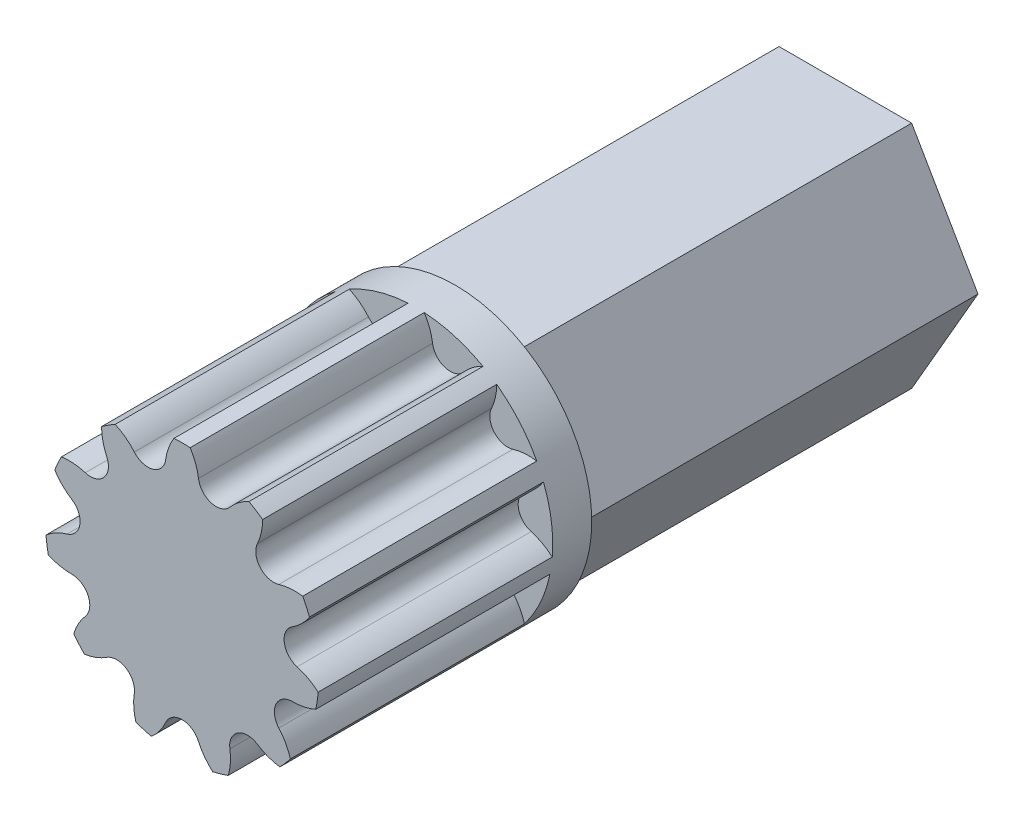
from build123d import *

# Parameters (mm, degrees)
BOSS_EXTRUDE1_DEPTH = 10
SKETCH2_R           = 3.5
BOSS_EXTRUDE2_DEPTH = 7
SKETCH5_OUTSIDE_W   = 12.934
SKETCH5_OUTSIDE_H   = 12.934
CUT_EXTRUDE1_DEPTH  = 6


with BuildPart() as part:
    # Sketch1 → Boss-Extrude1 (new body)
    with BuildSketch(Plane.XY):
        Polygon((3.4, 0), (1.7, 2.944486373), (-1.7, 2.944486373), (-3.4, 0), (-1.7, -2.944486373), (1.7, -2.944486373), align=None)
    extrude(amount=BOSS_EXTRUDE1_DEPTH)

    # Sketch2 → Boss-Extrude2 (add)
    with BuildSketch(Plane.XY.offset(10)):
        Circle(SKETCH2_R)
    extrude(amount=BOSS_EXTRUDE2_DEPTH)

    # Sketch5 outside → Cut-Extrude1 (cut)
    with BuildSketch(Plane.XY.offset(17)):
        Rectangle(SKETCH5_OUTSIDE_W, SKETCH5_OUTSIDE_H)
        with BuildLine():
            ThreePointArc((-1.225048855, -2.680805064), (-1.222210326, -2.658421079), (-1.220475879, -2.635924597))
            ThreePointArc((-1.220475879, -2.635924597), (-1.430570177, -2.226010646), (-1.890717348, -2.20518656))
            ThreePointArc((-1.890717348, -2.20518656), (-1.910460352, -2.216109645), (-1.929642373, -2.227990304))
            ThreePointArc((-1.929642373, -2.227990304), (-2.205665987, -2.368094557), (-2.505525497, -2.444922359))
            ThreePointArc((-2.505525497, -2.444922359), (-2.645696022, -2.292508653), (-2.776610031, -2.13207413))
            ThreePointArc((-2.776610031, -2.13207413), (-2.657889767, -1.846200494), (-2.479929318, -1.592925316))
            ThreePointArc((-2.479929318, -1.592925316), (-2.4654397, -1.575629335), (-2.451818074, -1.557641803))
            ThreePointArc((-2.451818074, -1.557641803), (-2.40694443, -1.09921469), (-2.782786513, -0.832922011))
            ThreePointArc((-2.782786513, -0.832922011), (-2.80530085, -0.831437221), (-2.827860963, -0.831061285))
            ThreePointArc((-2.827860963, -0.831061285), (-3.135812881, -0.79969485), (-3.429606999, -0.702210219))
            ThreePointArc((-3.429606999, -0.702210219), (-3.465124877, -0.498209743), (-3.488519299, -0.292466177))
            ThreePointArc((-3.488519299, -0.292466177), (-3.234090501, -0.116158991), (-2.947449745, 0.000696964))
            ThreePointArc((-2.947449745, 0.000696964), (-2.925909389, 0.00741359), (-2.904725354, 0.015181258))
            ThreePointArc((-2.904725354, 0.015181258), (-2.619130834, 0.376574163), (-2.791340622, 0.80378939))
            ThreePointArc((-2.791340622, 0.80378939), (-2.80947815, 0.817210645), (-2.828253678, 0.829723821))
            ThreePointArc((-2.828253678, 0.829723821), (-3.070361342, 1.022602322), (-3.264812511, 1.263448704))
            ThreePointArc((-3.264812511, 1.263448704), (-3.184401067, 1.454267239), (-3.092848337, 1.63999772))
            ThreePointArc((-3.092848337, 1.63999772), (-2.783490351, 1.65076217), (-2.479175704, 1.594097963))
            ThreePointArc((-2.479175704, 1.594097963), (-2.457423521, 1.588102753), (-2.435402858, 1.583184377))
            ThreePointArc((-2.435402858, 1.583184377), (-1.999761704, 1.73280338), (-1.913663807, 2.18530334))
            ThreePointArc((-1.913663807, 2.18530334), (-1.921665988, 2.206399906), (-1.930695833, 2.227077476))
            ThreePointArc((-1.930695833, 2.227077476), (-2.030091771, 2.520230481), (-2.063463119, 2.82797159))
            ThreePointArc((-2.063463119, 2.82797159), (-1.892652419, 2.945024649), (-1.715219882, 3.051773929))
            ThreePointArc((-1.715219882, 3.051773929), (-1.449151682, 2.893578006), (-1.223780893, 2.681384122))
            ThreePointArc((-1.223780893, 2.681384122), (-1.208723048, 2.664580512), (-1.192857163, 2.648537642))
            ThreePointArc((-1.192857163, 2.648537642), (-0.745482362, 2.538879767), (-0.428412254, 2.87299892))
            ThreePointArc((-0.428412254, 2.87299892), (-0.423738452, 2.895072786), (-0.420155704, 2.917349768))
            ThreePointArc((-0.420155704, 2.917349768), (-0.345282406, 3.217703271), (-0.206978766, 3.494633479))
            ThreePointArc((-0.206978766, 3.494633479), (-0.103534673, 3.499226191), (0, 3.500757541))
            ThreePointArc((0, 3.500757541), (0.103534673, 3.499226191), (0.206978766, 3.494633479))
            ThreePointArc((0.206978766, 3.494633479), (0.345282406, 3.217703271), (0.420155704, 2.917349768))
            ThreePointArc((0.420155704, 2.917349768), (0.423738452, 2.895072786), (0.428412254, 2.87299892))
            ThreePointArc((0.428412254, 2.87299892), (0.745482362, 2.538879767), (1.192857163, 2.648537642))
            ThreePointArc((1.192857163, 2.648537642), (1.208723048, 2.664580512), (1.223780893, 2.681384122))
            ThreePointArc((1.223780893, 2.681384122), (1.449151682, 2.893578006), (1.715219882, 3.051773929))
            ThreePointArc((1.715219882, 3.051773929), (1.892652419, 2.945024649), (2.063463119, 2.82797159))
            ThreePointArc((2.063463119, 2.82797159), (2.030091771, 2.520230481), (1.930695833, 2.227077476))
            ThreePointArc((1.930695833, 2.227077476), (1.921665988, 2.206399906), (1.913663807, 2.18530334))
            ThreePointArc((1.913663807, 2.18530334), (1.999761704, 1.73280338), (2.435402858, 1.583184377))
            ThreePointArc((2.435402858, 1.583184377), (2.457423521, 1.588102753), (2.479175704, 1.594097963))
            ThreePointArc((2.479175704, 1.594097963), (2.783490351, 1.65076217), (3.092848337, 1.63999772))
            ThreePointArc((3.092848337, 1.63999772), (3.184401067, 1.454267239), (3.264812511, 1.263448704))
            ThreePointArc((3.264812511, 1.263448704), (3.070361342, 1.022602322), (2.828253678, 0.829723821))
            ThreePointArc((2.828253678, 0.829723821), (2.80947815, 0.817210645), (2.791340622, 0.80378939))
            ThreePointArc((2.791340622, 0.80378939), (2.619130834, 0.376574163), (2.904725354, 0.015181258))
            ThreePointArc((2.904725354, 0.015181258), (2.925909389, 0.00741359), (2.947449745, 0.000696964))
            ThreePointArc((2.947449745, 0.000696964), (3.234090501, -0.116158991), (3.488519299, -0.292466177))
            ThreePointArc((3.488519299, -0.292466177), (3.465124877, -0.498209743), (3.429606999, -0.702210219))
            ThreePointArc((3.429606999, -0.702210219), (3.135812881, -0.79969485), (2.827860963, -0.831061285))
            ThreePointArc((2.827860963, -0.831061285), (2.80530085, -0.831437221), (2.782786513, -0.832922011))
            ThreePointArc((2.782786513, -0.832922011), (2.40694443, -1.09921469), (2.451818074, -1.557641803))
            ThreePointArc((2.451818074, -1.557641803), (2.4654397, -1.575629335), (2.479929318, -1.592925316))
            ThreePointArc((2.479929318, -1.592925316), (2.657889767, -1.846200494), (2.776610031, -2.13207413))
            ThreePointArc((2.776610031, -2.13207413), (2.645696022, -2.292508653), (2.505525497, -2.444922359))
            ThreePointArc((2.505525497, -2.444922359), (2.205665989, -2.368094556), (1.929642376, -2.227990303))
            ThreePointArc((1.929642376, -2.227990303), (1.910460355, -2.216109643), (1.890717351, -2.205186558))
            ThreePointArc((1.890717351, -2.205186558), (1.430570178, -2.226010644), (1.220475879, -2.635924598))
            ThreePointArc((1.220475879, -2.635924598), (1.222210326, -2.65842108), (1.225048855, -2.680805065))
            ThreePointArc((1.225048855, -2.680805065), (1.237827812, -2.990086385), (1.183146697, -3.294763611))
            ThreePointArc((1.183146697, -3.294763611), (0.986277373, -3.358952263), (0.785957353, -3.411388925))
            ThreePointArc((0.785957353, -3.411388925), (0.575235727, -3.184640974), (0.418775964, -2.917548145))
            ThreePointArc((0.418775964, -2.917548145), (0.409062191, -2.897182914), (0.398358784, -2.877319957))
            ThreePointArc((0.398358784, -2.877319957), (0, -2.646063949), (-0.398358784, -2.877319956))
            ThreePointArc((-0.398358784, -2.877319956), (-0.409062191, -2.897182914), (-0.418775964, -2.917548145))
            ThreePointArc((-0.418775964, -2.917548145), (-0.575235727, -3.184640974), (-0.785957353, -3.411388925))
            ThreePointArc((-0.785957353, -3.411388925), (-0.986277373, -3.358952263), (-1.183146697, -3.294763611))
            ThreePointArc((-1.183146697, -3.294763611), (-1.237827813, -2.990086384), (-1.225048855, -2.680805064))
        make_face(mode=Mode.SUBTRACT)
    extrude(amount=-CUT_EXTRUDE1_DEPTH, mode=Mode.SUBTRACT)


solid = part.part
